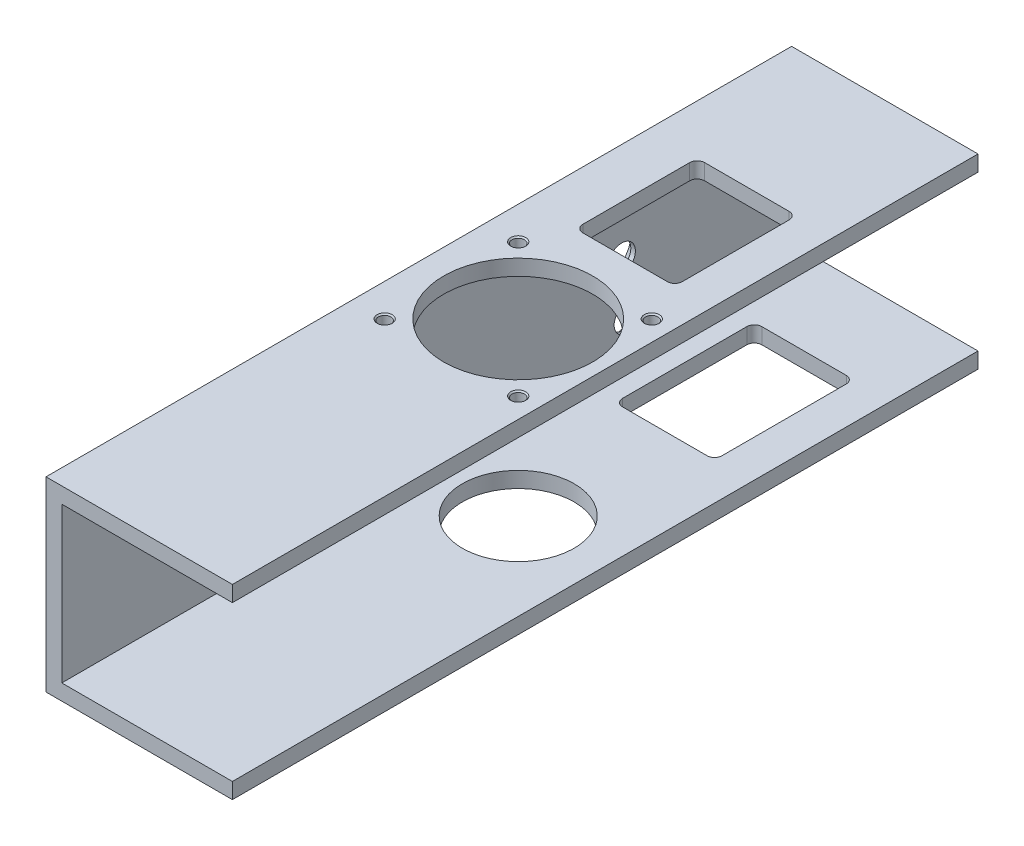
from build123d import *

# Parameters (mm, degrees)
BOSS_EXTRUDE1_DEPTH                                  = 300
SKETCH2_R                                            = 30
CUT_EXTRUDE1_DEPTH                                   = 319.198051534
SKETCH3_W                                            = 40
SKETCH3_H                                            = 56
CUT_EXTRUDE2_DEPTH                                   = 10
SKETCH4_W                                            = 40
SKETCH4_H                                            = 49
CUT_EXTRUDE3_DEPTH                                   = 10
FILLET1_R                                            = 3
CSK_FOR_M10_COUNTERSUNK_FLAT_HEAD_SCREW1_D           = 11
CSK_FOR_M10_COUNTERSUNK_FLAT_HEAD_SCREW1_DEPTH       = 20.003
CSK_FOR_M10_COUNTERSUNK_FLAT_HEAD_SCREW1_CSINK_D     = 20
CSK_FOR_M10_COUNTERSUNK_FLAT_HEAD_SCREW1_CSINK_ANGLE = 90
CSK_FOR_M10_COUNTERSUNK_FLAT_HEAD_SCREW1_TIP         = 3.304733405
BOSS_EXTRUDE2_START                                  = -6.35
SKETCH7_R                                            = 30
SKETCH7_R_2                                          = 22.5
BOSS_EXTRUDE2_DEPTH                                  = 6.35
M6X1_0_TAPPED_HOLE1_D                                = 5
M6X1_0_TAPPED_HOLE1_DEPTH                            = 15
M6X1_0_TAPPED_HOLE1_CSINK_D                          = 6.05
M6X1_0_TAPPED_HOLE1_CSINK_ANGLE                      = 90
M6X1_0_TAPPED_HOLE1_TIP                              = 1.502151548


with BuildPart() as part:
    # Sketch1 → Boss-Extrude1 (new body)
    with BuildSketch(Plane.XY):
        Polygon((0, -37.5), (0, 37.5), (75, 37.5), (75, 31.15), (6.35, 31.15), (6.35, -31.15), (75, -31.15), (75, -37.5), align=None)
    extrude(amount=BOSS_EXTRUDE1_DEPTH)

    # Sketch2 → Cut-Extrude1 (cut, through all)
    with BuildSketch(Plane(origin=(0, 37.5, 0), x_dir=(1, 0, 0), z_dir=(0, 1, 0))):
        with Locations(Location((40, -150, 0), (0, 0, 270))):
            Circle(SKETCH2_R)
    extrude(amount=-CUT_EXTRUDE1_DEPTH, mode=Mode.SUBTRACT)

    # Sketch3 → Cut-Extrude2 (cut)
    with BuildSketch(Plane.XZ.offset(37.5)):
        with Locations((40, 63)):
            Rectangle(SKETCH3_W, SKETCH3_H)
    extrude(amount=-CUT_EXTRUDE2_DEPTH, mode=Mode.SUBTRACT)

    # Sketch4 → Cut-Extrude3 (cut)
    with BuildSketch(Plane(origin=(0, 37.5, 0), x_dir=(1, 0, 0), z_dir=(0, 1, 0))):
        with Locations((40, -82.5)):
            Rectangle(SKETCH4_W, SKETCH4_H)
    extrude(amount=-CUT_EXTRUDE3_DEPTH, mode=Mode.SUBTRACT)

    # Fillet1
    fillet1_edges = [part.edges().sort_by_distance(p)[0] for p in [
        (20, -34.325, 91),
        (60, -34.325, 91),
        (60, -34.325, 35),
        (20, -34.325, 35),
        (60, 34.325, 107),
        (20, 34.325, 107),
        (20, 34.325, 58),
        (60, 34.325, 58),
    ]]
    fillet(fillet1_edges, radius=FILLET1_R)

    # CSK for M10 Countersunk Flat Head Screw1
    with Locations(Plane.ZY):
        with Locations((74.704121605, 4.01110333), (72.25, -17.6)):
            CounterSinkHole(CSK_FOR_M10_COUNTERSUNK_FLAT_HEAD_SCREW1_D / 2, CSK_FOR_M10_COUNTERSUNK_FLAT_HEAD_SCREW1_CSINK_D / 2, depth=CSK_FOR_M10_COUNTERSUNK_FLAT_HEAD_SCREW1_DEPTH, counter_sink_angle=CSK_FOR_M10_COUNTERSUNK_FLAT_HEAD_SCREW1_CSINK_ANGLE)
            with Locations((0, 0, -(CSK_FOR_M10_COUNTERSUNK_FLAT_HEAD_SCREW1_DEPTH + CSK_FOR_M10_COUNTERSUNK_FLAT_HEAD_SCREW1_TIP / 2))):  # 118° drill point
                Cone(0, CSK_FOR_M10_COUNTERSUNK_FLAT_HEAD_SCREW1_D / 2, CSK_FOR_M10_COUNTERSUNK_FLAT_HEAD_SCREW1_TIP, mode=Mode.SUBTRACT)

    # Sketch7 → Boss-Extrude2 (add)
    with BuildSketch(Plane.XZ.offset(37.5).offset(BOSS_EXTRUDE2_START)):
        with Locations(Location((40, 150, 0), (0, 0, 90))):
            Circle(SKETCH7_R)
        with Locations(Location((40, 150, 0), (0, 0, 270))):
            Circle(SKETCH7_R_2, mode=Mode.SUBTRACT)
    extrude(amount=BOSS_EXTRUDE2_DEPTH)

    # M6x1.0 Tapped Hole1
    with Locations(Plane(origin=(0, 37.5, 0), x_dir=(1, 0, 0), z_dir=(0, 1, 0))):
        with Locations((66.870057685, -123.129942315), (13.129942315, -123.129942315), (13.129942315, -176.870057685), (66.870057685, -176.870057685)):
            CounterSinkHole(M6X1_0_TAPPED_HOLE1_D / 2, M6X1_0_TAPPED_HOLE1_CSINK_D / 2, depth=M6X1_0_TAPPED_HOLE1_DEPTH, counter_sink_angle=M6X1_0_TAPPED_HOLE1_CSINK_ANGLE)
            with Locations((0, 0, -(M6X1_0_TAPPED_HOLE1_DEPTH + M6X1_0_TAPPED_HOLE1_TIP / 2))):  # 118° drill point
                Cone(0, M6X1_0_TAPPED_HOLE1_D / 2, M6X1_0_TAPPED_HOLE1_TIP, mode=Mode.SUBTRACT)


solid = part.part
